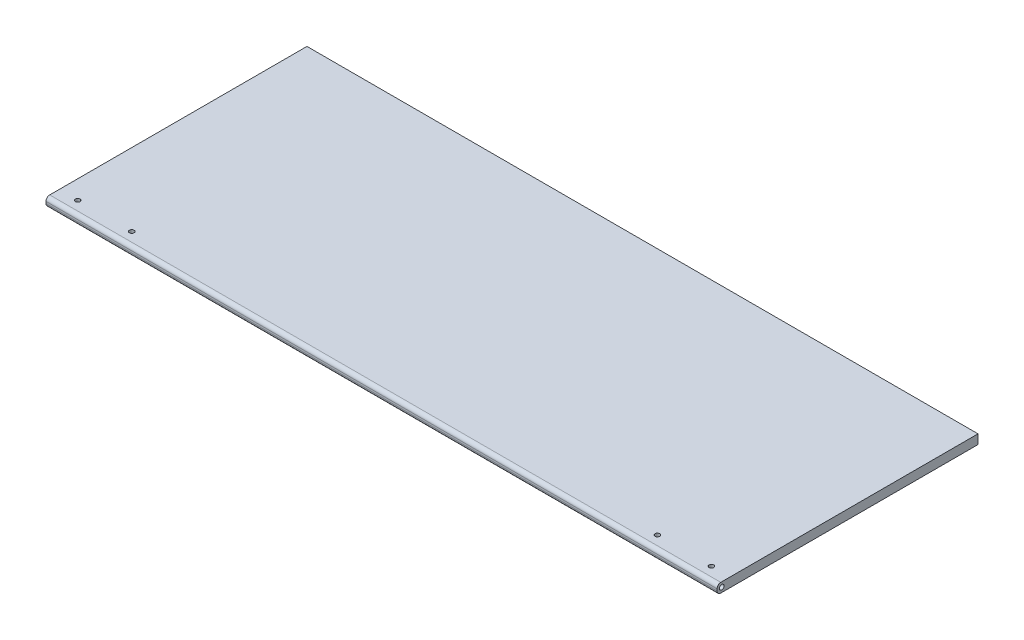
from build123d import *

# Parameters (mm, degrees)
SKETCH1_W           = 457.2
SKETCH1_H           = 177.8
BOSS_EXTRUDE1_DEPTH = 6.35
SKETCH2_R           = 1.5875
CUT_EXTRUDE1_DEPTH  = 466.806153351
FILLET1_R           = 2.54
SKETCH4_R           = 1.5875
CUT_EXTRUDE3_DEPTH  = 246.359924397


with BuildPart() as part:
    # Sketch1 → Boss-Extrude1 (new body)
    with BuildSketch(Plane(origin=(0, 0, 0), x_dir=(1, 0, 0), z_dir=(0, 1, 0))):
        Rectangle(SKETCH1_W, SKETCH1_H)
    extrude(amount=BOSS_EXTRUDE1_DEPTH)

    # Sketch2 → Cut-Extrude1 (cut, through all)
    with BuildSketch(Plane.ZY.offset(228.6)):
        with Locations((85.725, 3.175)):
            Circle(SKETCH2_R)
    extrude(amount=-CUT_EXTRUDE1_DEPTH, mode=Mode.SUBTRACT)

    # Fillet1
    fillet1_edges = [part.edges().sort_by_distance(p)[0] for p in [
        (0, 6.35, 88.9),
        (0, 0, 88.9),
    ]]
    fillet(fillet1_edges, radius=FILLET1_R)

    # Sketch4 → Cut-Extrude3 (cut, through all)
    with BuildSketch(Plane.XZ):
        with Locations(Location((-179.07, 80.01, 0), (0, 0, 270))):
            Circle(SKETCH4_R)
        with Locations(Location((-215.9, 80.01, 0), (0, 0, 270))):
            Circle(SKETCH4_R)
    cut_extrude3 = extrude(amount=-CUT_EXTRUDE3_DEPTH, mode=Mode.SUBTRACT)

    # Mirror1: Cut-Extrude3 across plane
    add(cut_extrude3.mirror(Plane(origin=(0, 0, 0), x_dir=(0, 0, 1), z_dir=(1, 0, 0))), mode=Mode.SUBTRACT)


solid = part.part
